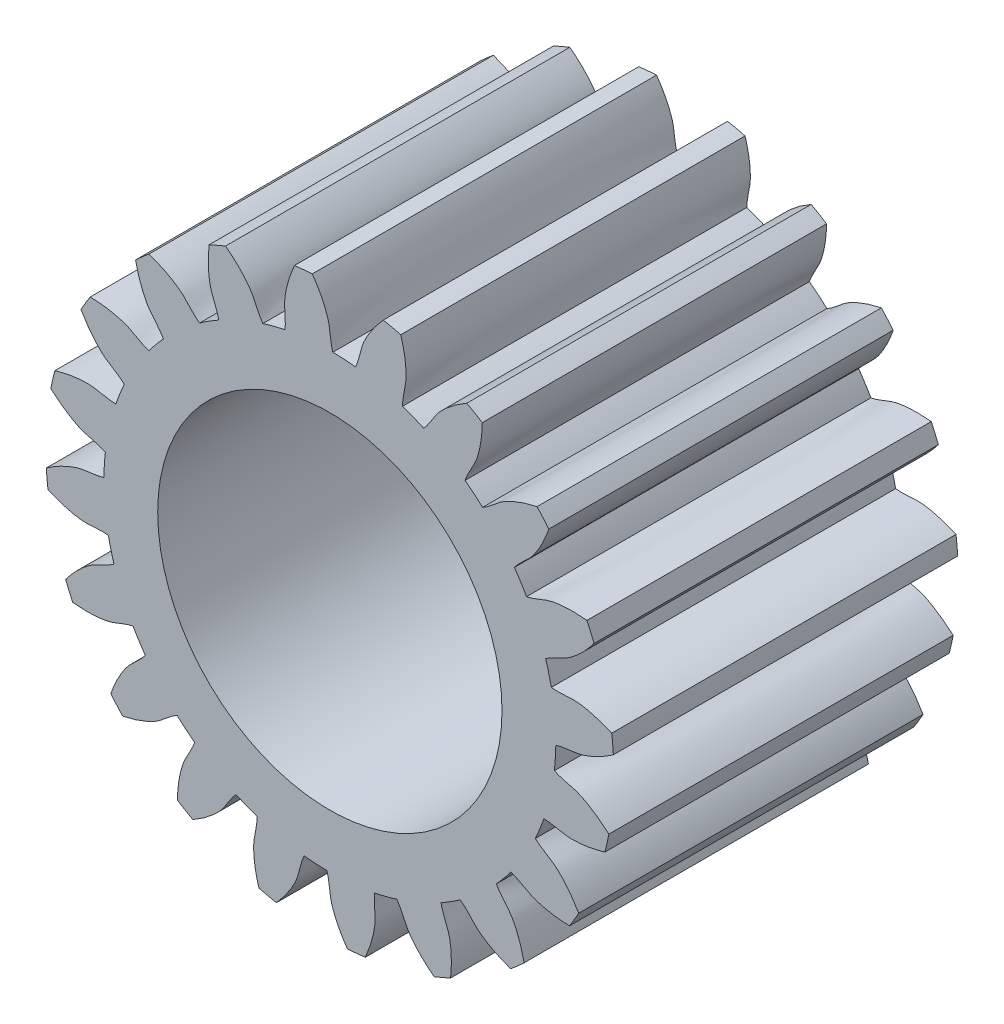
from build123d import *

# Parameters (mm, degrees)
SKETCH_1_R               = 13.125
SKETCH_1_R_2             = 10
EXTRUDE_1_DEPTH          = 20
EXTRUDE_2_DEPTH          = 20
PATTERN_CIRCULAR_1_COUNT = 20


with BuildPart() as part:
    # 草图1 → 凸台-拉伸1 (new body)
    with BuildSketch(Plane.XY):
        Circle(SKETCH_1_R)
        Circle(SKETCH_1_R_2, mode=Mode.SUBTRACT)
    extrude(amount=EXTRUDE_1_DEPTH)

    # 草图2 → 凸台-拉伸2 (add)
    with BuildSketch(Plane.XY):
        with BuildLine():
            ThreePointArc((16.3712005, 2.057618574), (16.4280149, 1.539586454), (16.468441403, 1.020018507))
            add(Edge.make_bspline(
                [(16.468441403, 1.020018507), (16.169415076, 0.812540965), (15.708324181, 0.530305208), (15.063216606, 0.241508427), (14.273878903, -0.039342943), (13.591991952, -0.018804555), (13.12386735, -0.172426172)],
                knots=[0, 0, 0, 0, 0.304014618, 0.449161344, 0.589717395, 1, 1, 1, 1], degree=3))
            ThreePointArc((13.12386735, -0.172426172), (13.067739125, 1.224671043), (12.863306007, 2.607869548))
            add(Edge.make_bspline(
                [(16.3712005, 2.057618574), (16.038831257, 2.205923533), (15.5333292, 2.397572971), (14.845795668, 2.561478448), (14.018019743, 2.690778565), (13.35182248, 2.54390159), (12.863306007, 2.607869548)],
                knots=[0, 0, 0, 0, 0.304014618, 0.449161344, 0.589717395, 1, 1, 1, 1], degree=3))
        make_face()
    extrude_2 = extrude(amount=EXTRUDE_2_DEPTH)

    # 阵列(圆周)1: 凸台-拉伸2 ×20 about axis
    pattern_circular_1_axis = Axis((0, 0, 20), (0, 0, -1))
    for i in range(1, PATTERN_CIRCULAR_1_COUNT):
        add(extrude_2.rotate(pattern_circular_1_axis, i * 360 / PATTERN_CIRCULAR_1_COUNT))


solid = part.part
